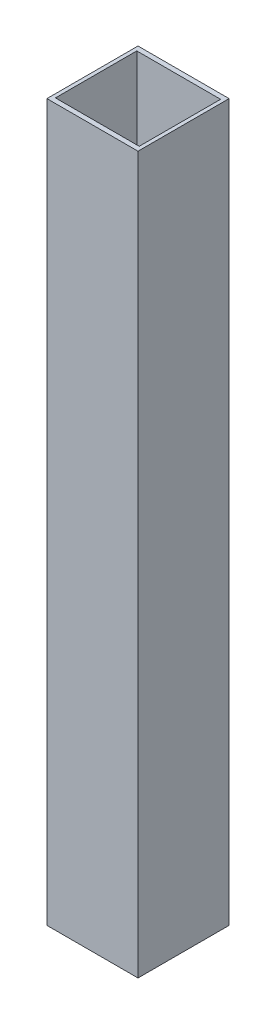
from build123d import *

# Parameters (mm, degrees)
SKETCH_1_W      = 15
SKETCH_1_H      = 15
SKETCH_1_W_2    = 13.8
SKETCH_1_H_2    = 13.4
EXTRUDE_1_DEPTH = 117.91


with BuildPart() as part:
    # 草图1 → 凸台-拉伸1 (new body)
    with BuildSketch(Plane(origin=(0, 0, 0), x_dir=(1, 0, 0), z_dir=(0, 1, 0))):
        Rectangle(SKETCH_1_W, SKETCH_1_H)
        Rectangle(SKETCH_1_W_2, SKETCH_1_H_2, mode=Mode.SUBTRACT)
    extrude(amount=EXTRUDE_1_DEPTH)


solid = part.part
